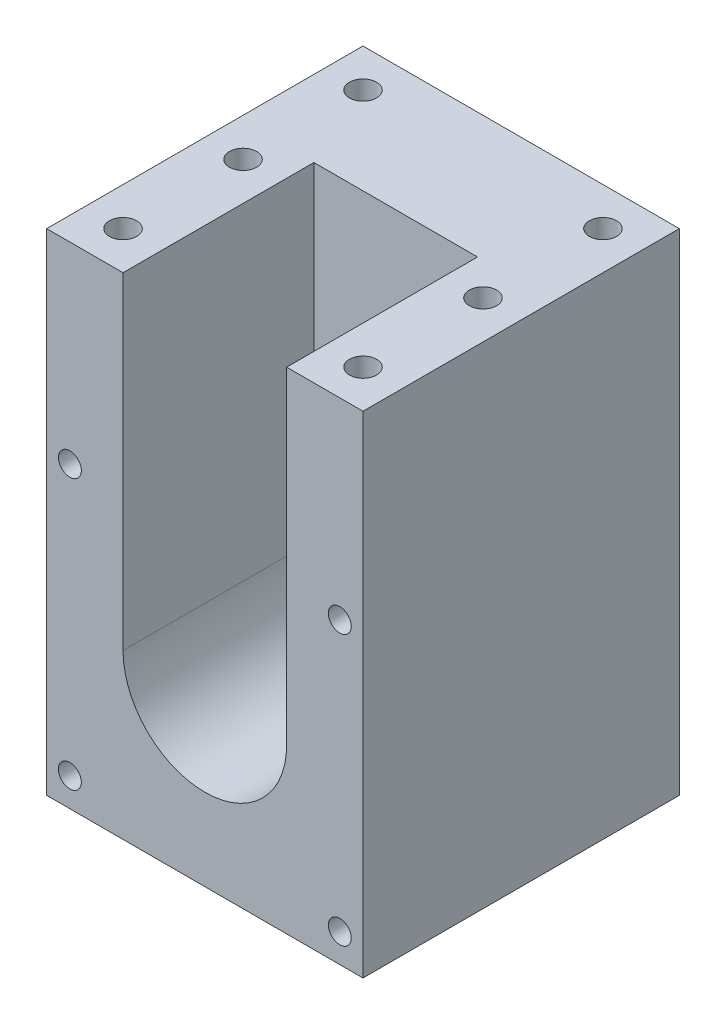
from build123d import *

# Parameters (mm, degrees)
BOSS_EXTRUDE1_DEPTH = 90
SKETCH3_R           = 11
CUT_EXTRUDE1_DEPTH  = 13
SKETCH4_R           = 8
CUT_EXTRUDE2_DEPTH  = 105.718670733
SKETCH5_R           = 15
CUT_EXTRUDE3_DEPTH  = 35
SKETCH6_W           = 30
SKETCH6_H           = 60
CUT_EXTRUDE4_DEPTH  = 35
M6_TAPPED_HOLE_D    = 5
M5_TAPPED_HOLE1_D   = 4.2


with BuildPart() as part:
    # Sketch2 → Boss-Extrude1 (new body)
    with BuildSketch(Plane(origin=(0, 0, 0), x_dir=(1, 0, 0), z_dir=(0, 1, 0))):
        Polygon((-29, 0), (0, 0), (29, 0), (29, 58), (-29, 58), align=None)
    extrude(amount=BOSS_EXTRUDE1_DEPTH)

    # Sketch3 → Cut-Extrude1 (cut)
    with BuildSketch(Plane.XY.offset(-58)):
        with Locations(Location((0, 30, 0), (0, 0, 180))):
            Circle(SKETCH3_R)
    extrude(amount=CUT_EXTRUDE1_DEPTH, mode=Mode.SUBTRACT)

    # Sketch4 → Cut-Extrude2 (cut, through all)
    with BuildSketch(Plane(origin=(0, 0, -45), x_dir=(-1, 0, 0), z_dir=(0, 0, -1))):
        with Locations((0, 30)):
            Circle(SKETCH4_R)
    extrude(amount=-CUT_EXTRUDE2_DEPTH, mode=Mode.SUBTRACT)

    # Sketch5 → Cut-Extrude3 (cut)
    with BuildSketch(Plane.XY):
        with Locations((0, 30)):
            Circle(SKETCH5_R)
    extrude(amount=-CUT_EXTRUDE3_DEPTH, mode=Mode.SUBTRACT)

    # Sketch6 → Cut-Extrude4 (cut)
    with BuildSketch(Plane.XY):
        with Locations((0, 60)):
            Rectangle(SKETCH6_W, SKETCH6_H)
    extrude(amount=-CUT_EXTRUDE4_DEPTH, mode=Mode.SUBTRACT)

    # M6 Tapped Hole (through all)
    with Locations(Plane(origin=(559.845790405, 100, -1460.886073068), x_dir=(-1, 0, 0), z_dir=(0, 1, 0))):
        with Locations((514.845790405, 897.471608895), (537.845790405, 897.471608895), (581.845790405, 897.471608895), (604.845790405, 897.471608895), (514.845790405, 1450.886073068), (514.845790405, 1412.886073068), (537.845790405, 1453.886073068), (537.845790405, 1409.886073068), (581.845790405, 1453.886073068), (581.845790405, 1409.886073068), (604.845790405, 1450.886073068), (604.845790405, 1412.886073068), (514.845790405, 1431.886073068), (537.845790405, 1431.886073068), (581.845790405, 1431.886073068), (604.845790405, 1431.886073068)):
            Hole(M6_TAPPED_HOLE_D / 2)

    # M5 Tapped Hole1 (through all)
    with Locations(Plane(origin=(559.845790405, -258.904934605, 0), x_dir=(-1, 0, 0), z_dir=(0, 0, 1))):
        with Locations((535.097053063, -264.156197264), (584.594527746, -264.156197264), (535.097053063, -313.653671947), (584.594527746, -313.653671947)):
            Hole(M5_TAPPED_HOLE1_D / 2)


solid = part.part
